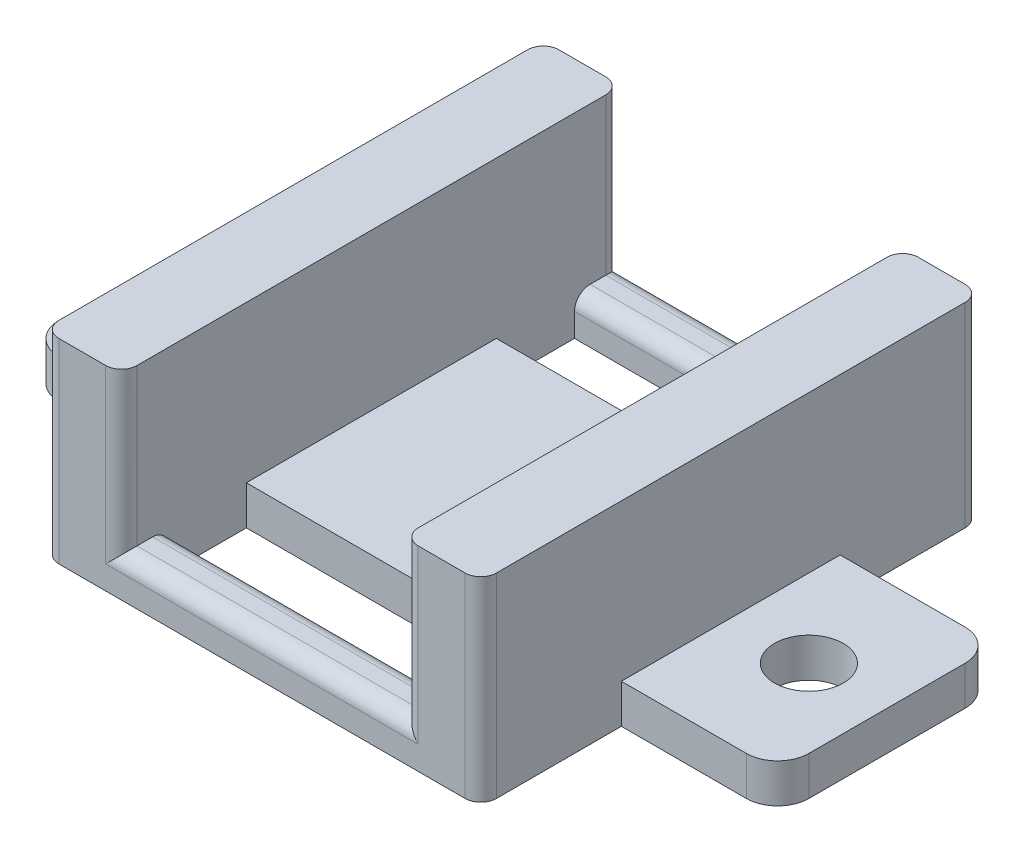
from build123d import *

# Parameters (mm, degrees)
SKETCH1_W           = 28
SKETCH1_H           = 32
BOSS_EXTRUDE1_DEPTH = 2.5
BOSS_EXTRUDE3_DEPTH = 10
SKETCH3_W           = 18
SKETCH3_H           = 8
CUT_EXTRUDE1_DEPTH  = 2.5
SKETCH4_W           = 10
SKETCH4_H           = 14
SKETCH4_R           = 2.2
BOSS_EXTRUDE4_DEPTH = 2.5
FILLET1_R           = 2
FILLET2_R           = 1
SKETCH5_W           = 24.202572411
SKETCH5_H           = 3
SKETCH5_W_2         = 23.282926667
BOSS_EXTRUDE5_DEPTH = 2.5
FILLET3_R           = 1


with BuildPart() as part:
    # Sketch1 → Boss-Extrude1 (new body)
    with BuildSketch(Plane(origin=(0, 0, 0), x_dir=(1, 0, 0), z_dir=(0, 1, 0))):
        with Locations((14, 16)):
            Rectangle(SKETCH1_W, SKETCH1_H)
    extrude(amount=BOSS_EXTRUDE1_DEPTH)

    # Sketch2 → Boss-Extrude3 (add)
    with BuildSketch(Plane(origin=(0, 2.5, 0), x_dir=(1, 0, 0), z_dir=(0, 1, 0))):
        Polygon((0, 32), (5, 32), (5, 30), (5, 0), (0, 0), align=None)
        Polygon((28, 0), (23, 0), (23, 30), (23, 32), (28, 32), align=None)
    extrude(amount=BOSS_EXTRUDE3_DEPTH)

    # Sketch3 → Cut-Extrude1 (cut)
    with BuildSketch(Plane(origin=(0, 2.5, 0), x_dir=(1, 0, 0), z_dir=(0, 1, 0))):
        with Locations((14, 28)):
            Rectangle(SKETCH3_W, SKETCH3_H)
        with Locations((14, 4)):
            Rectangle(SKETCH3_W, SKETCH3_H)
    extrude(amount=-CUT_EXTRUDE1_DEPTH, mode=Mode.SUBTRACT)

    # Sketch4 → Boss-Extrude4 (add)
    # profile 1 of 2: a face of its own
    with BuildSketch(Plane.XZ):
        with Locations((-5, -16)):
            Rectangle(SKETCH4_W, SKETCH4_H)
        with Locations(Location((-5, -16, 0), (0, 0, 270))):
            Circle(SKETCH4_R, mode=Mode.SUBTRACT)
    # profile 2 of 2: a face of its own
    with BuildSketch(Plane.XZ):
        with Locations((33, -16)):
            Rectangle(SKETCH4_W, SKETCH4_H)
        with Locations(Location((33, -16, 0), (0, 0, 270))):
            Circle(SKETCH4_R, mode=Mode.SUBTRACT)
    extrude(amount=-BOSS_EXTRUDE4_DEPTH)

    # Fillet1
    fillet1_edges = [part.edges().sort_by_distance(p)[0] for p in [
        (-10, 1.25, -23),
        (-10, 1.25, -9),
        (38, 1.25, -9),
        (38, 1.25, -23),
    ]]
    fillet(fillet1_edges, radius=FILLET1_R)

    # Fillet2
    fillet2_edges = [part.edges().sort_by_distance(p)[0] for p in [
        (23, 6.25, -32),
        (23, 6.25, 0),
        (5, 6.25, 0),
        (5, 6.25, -32),
        (0, 6.25, -32),
        (28, 6.25, -32),
        (28, 6.25, 0),
        (0, 6.25, 0),
    ]]
    fillet(fillet2_edges, radius=FILLET2_R)

    # Sketch5 → Boss-Extrude5 (add)
    with BuildSketch(Plane.XZ):
        with Locations((14.601286206, -1.5)):
            Rectangle(SKETCH5_W, SKETCH5_H)
        with Locations((14.141463334, -30.5)):
            Rectangle(SKETCH5_W_2, SKETCH5_H)
    extrude(amount=-BOSS_EXTRUDE5_DEPTH)

    # Fillet3
    fillet3_edges = [part.edges().sort_by_distance(p)[0] for p in [
        (14, 2.5, -3),
        (14, 2.5, 0),
        (14, 2.5, -32),
        (14, 2.5, -29),
    ]]
    fillet(fillet3_edges, radius=FILLET3_R)


solid = part.part
